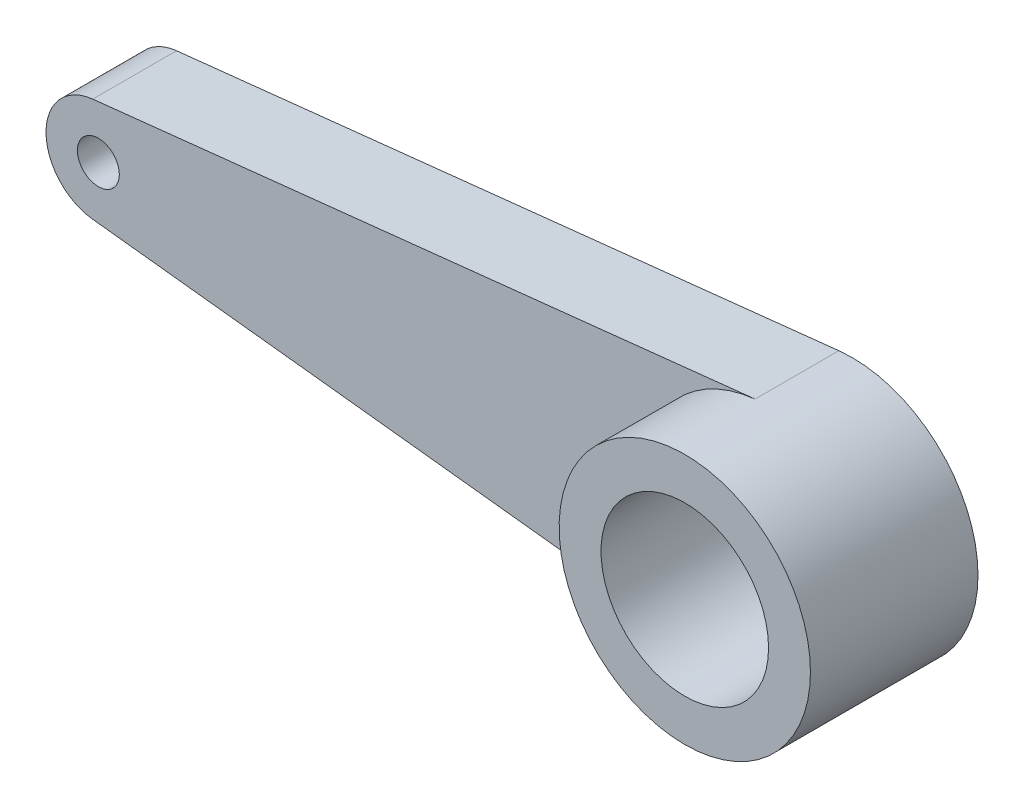
from build123d import *

# Parameters (mm, degrees)
SKETCH_1_R      = 2
EXTRUDE_1_DEPTH = 4
SKETCH_1_3_R    = 0.5
EXTRUDE_2_DEPTH = 2


with BuildPart() as part:
    # 草图1 → 凸台-拉伸1 (new body)
    with BuildSketch(Plane.XY):
        with BuildLine():
            ThreePointArc((-0.321491523, 2.982724124), (-2.999992581, 0.006671881), (-0.334755231, -2.981264654))
            ThreePointArc((-0.334755231, -2.981264654), (1.999466717, -2.236544846), (3, 0))
            ThreePointArc((3, 0), (2.00443576, 2.23209258), (-0.321491523, 2.982724124))
        make_face()
        Circle(SKETCH_1_R, mode=Mode.SUBTRACT)
    extrude(amount=EXTRUDE_1_DEPTH)

    # 草图1<3> → 凸台-拉伸2 (add)
    with BuildSketch(Plane.XY):
        with BuildLine():
            ThreePointArc((-16.133954801, 1.278385172), (-17.249996909, 0.038363404), (-16.139481346, -1.206610152))
            Line((-16.139481346, -1.206610152), (-0.334755231, -2.981264654))
            ThreePointArc((-0.334755231, -2.981264654), (-2.999992581, 0.006671881), (-0.321491523, 2.982724124))
            Line((-0.321491523, 2.982724124), (-16.133954801, 1.278385172))
        make_face()
        with Locations((-16, 0.035583454)):
            Circle(SKETCH_1_3_R, mode=Mode.SUBTRACT)
    extrude(amount=EXTRUDE_2_DEPTH)


solid = part.part
